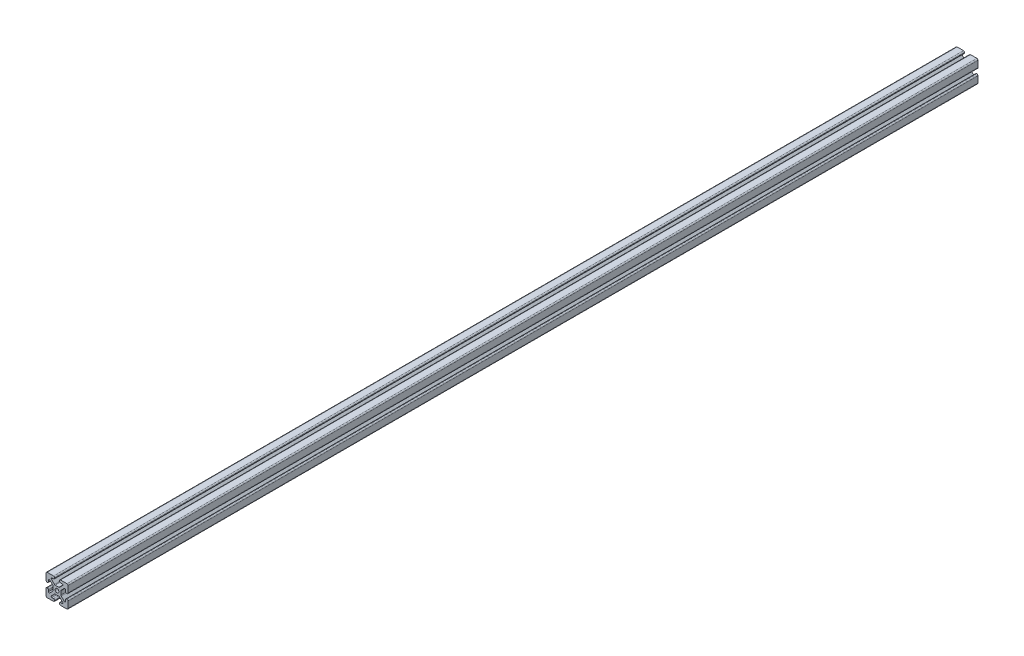
from build123d import *

# Parameters (mm, degrees)
SKETCH1_W           = 2.6797
SKETCH1_H           = 2.6797
BOSS_EXTRUDE1_DEPTH = 1574.8
FILLET2_R           = 2.032
FILLET3_R           = 2.032
FILLET4_R           = 1.27


with BuildPart() as part:
    # Sketch1 → Boss-Extrude1 (new body)
    with BuildSketch(Plane.XY):
        Polygon((-19.05, 16.176318041), (-19.05, 14.7447), (-17.618381959, 14.7447), align=None)
        Polygon((-14.7447, 17.618381959), (-14.7447, 19.05), (-16.176318041, 19.05), align=None)
        Polygon((14.7447, 19.05), (14.7447, 17.618381959), (16.176318041, 19.05), align=None)
        Polygon((17.618381959, 14.7447), (19.05, 14.7447), (19.05, 16.176318041), align=None)
        Polygon((19.05, -14.7447), (17.618381959, -14.7447), (19.05, -16.176318041), align=None)
        Polygon((16.176318041, -19.05), (14.7447, -17.618381959), (14.7447, -19.05), align=None)
        Polygon((19.05, -16.176318041), (17.618381959, -14.7447), (14.7447, -14.7447), (14.7447, -17.618381959), (16.176318041, -19.05), (19.05, -19.05), align=None)
        Polygon((19.05, -4.064), (14.7447, -4.064), (14.7447, -11.871018041), (17.618381959, -14.7447), (19.05, -14.7447), align=None)
        Polygon((17.618381959, -14.7447), (14.7447, -11.871018041), (14.7447, -14.7447), align=None)
        Polygon((14.7447, -14.7447), (11.871018041, -14.7447), (14.7447, -17.618381959), align=None)
        Polygon((11.871018041, -14.7447), (4.064, -14.7447), (4.064, -19.05), (14.7447, -19.05), (14.7447, -17.618381959), align=None)
        Polygon((14.7447, 6.7437), (14.7447, 4.064), (19.05, 4.064), (19.05, 14.7447), (17.618381959, 14.7447), (14.7447, 11.871018041), align=None)
        Polygon((14.7447, 14.7447), (14.7447, 11.871018041), (17.618381959, 14.7447), align=None)
        Polygon((16.176318041, 19.05), (14.7447, 17.618381959), (14.7447, 14.7447), (17.618381959, 14.7447), (19.05, 16.176318041), (19.05, 19.05), align=None)
        Polygon((4.064, 19.05), (4.064, 14.7447), (11.871018041, 14.7447), (14.7447, 17.618381959), (14.7447, 19.05), align=None)
        Polygon((14.7447, 17.618381959), (11.871018041, 14.7447), (14.7447, 14.7447), align=None)
        Polygon((-6.7437, 14.7447), (-4.064, 14.7447), (-4.064, 19.05), (-14.7447, 19.05), (-14.7447, 17.618381959), (-11.871018041, 14.7447), align=None)
        Polygon((-14.7447, 14.7447), (-11.871018041, 14.7447), (-14.7447, 17.618381959), align=None)
        Polygon((-14.7447, 14.7447), (-14.7447, 17.618381959), (-16.176318041, 19.05), (-19.05, 19.05), (-19.05, 16.176318041), (-17.618381959, 14.7447), align=None)
        Polygon((-17.618381959, 14.7447), (-14.7447, 11.871018041), (-14.7447, 14.7447), align=None)
        Polygon((-19.05, 4.064), (-14.7447, 4.064), (-14.7447, 6.7437), (-14.7447, 11.871018041), (-17.618381959, 14.7447), (-19.05, 14.7447), align=None)
        Polygon((-14.7447, -11.871018041), (-14.7447, -4.064), (-19.05, -4.064), (-19.05, -14.7447), (-17.618381959, -14.7447), align=None)
        Polygon((-14.7447, -14.7447), (-14.7447, -11.871018041), (-17.618381959, -14.7447), align=None)
        Polygon((-19.05, -16.176318041), (-17.618381959, -14.7447), (-19.05, -14.7447), align=None)
        Polygon((-14.7447, -14.7447), (-17.618381959, -14.7447), (-19.05, -16.176318041), (-19.05, -19.05), (-16.176318041, -19.05), (-14.7447, -17.618381959), align=None)
        Polygon((-16.176318041, -19.05), (-14.7447, -19.05), (-14.7447, -17.618381959), align=None)
        Polygon((-14.7447, -17.618381959), (-11.871018041, -14.7447), (-14.7447, -14.7447), align=None)
        Polygon((-4.064, -19.05), (-4.064, -14.7447), (-6.7437, -14.7447), (-11.871018041, -14.7447), (-14.7447, -17.618381959), (-14.7447, -19.05), align=None)
        Polygon((-6.7437, -6.7437), (-6.7437, -4.064), (-6.937681959, -4.064), (-14.7447, -11.871018041), (-14.7447, -14.7447), (-11.871018041, -14.7447), (-6.7437, -9.617381959), align=None)
        Polygon((-4.064, -6.937681959), (-4.064, -6.7437), (-6.7437, -6.7437), (-6.7437, -9.617381959), align=None)
        with Locations((-5.40385, -5.40385)):
            Rectangle(SKETCH1_W, SKETCH1_H)
        Polygon((6.7437, -6.7437), (4.064, -6.7437), (4.064, -6.937681959), (11.871018041, -14.7447), (14.7447, -14.7447), (14.7447, -11.871018041), (6.937681959, -4.064), (6.7437, -4.064), align=None)
        Polygon((4.064, 6.937681959), (4.064, 6.7437), (6.7437, 6.7437), (9.617381959, 6.7437), (14.7447, 11.871018041), (14.7447, 14.7447), (11.871018041, 14.7447), align=None)
        Polygon((6.7437, 6.7437), (6.7437, 4.064), (6.937681959, 4.064), (9.617381959, 6.7437), align=None)
        Polygon((-9.617381959, 6.7437), (-6.7437, 6.7437), (-6.7437, 9.617381959), (-11.871018041, 14.7447), (-14.7447, 14.7447), (-14.7447, 11.871018041), align=None)
        Polygon((-6.7437, 6.7437), (-4.064, 6.7437), (-4.064, 6.937681959), (-6.7437, 9.617381959), align=None)
        Polygon((-6.937681959, 4.064), (-6.7437, 4.064), (-6.7437, 6.7437), (-9.617381959, 6.7437), align=None)
        with Locations((-5.40385, 5.40385)):
            Rectangle(SKETCH1_W, SKETCH1_H)
        Polygon((-6.7437, 3.870018041), (-4.064, 1.190318041), (-4.064, 4.064), (-6.7437, 4.064), align=None)
        Polygon((-4.064, -1.190318041), (-4.064, 1.190318041), (-6.7437, 3.870018041), (-6.7437, -3.870018041), align=None)
        with BuildLine():
            ThreePointArc((-3.299979026, 0.426297067), (-2.352827104, 2.352827104), (-0.426297067, 3.299979026))
            Line((-0.426297067, 3.299979026), (-1.190318041, 4.064))
            Line((-1.190318041, 4.064), (-4.064, 4.064))
            Line((-4.064, 4.064), (-4.064, 1.190318041))
            Line((-4.064, 1.190318041), (-3.299979026, 0.426297067))
        make_face()
        Polygon((-4.064, 4.064), (-1.190318041, 4.064), (-3.870018041, 6.7437), (-4.064, 6.7437), align=None)
        Polygon((-1.190318041, 4.064), (0, 4.064), (0, 6.7437), (-3.870018041, 6.7437), align=None)
        with BuildLine():
            ThreePointArc((-0.426297067, 3.299979026), (-0.213589032, 3.32053768), (0, 3.3274))
            Line((0, 3.3274), (0, 4.064))
            Line((0, 4.064), (-1.190318041, 4.064))
            Line((-1.190318041, 4.064), (-0.426297067, 3.299979026))
        make_face()
        with BuildLine():
            Line((0, 4.064), (0, 3.3274))
            ThreePointArc((0, 3.3274), (0.213589032, 3.32053768), (0.426297067, 3.299979026))
            Line((0.426297067, 3.299979026), (1.190318041, 4.064))
            Line((1.190318041, 4.064), (0, 4.064))
        make_face()
        Polygon((0, 6.7437), (0, 4.064), (1.190318041, 4.064), (3.870018041, 6.7437), align=None)
        Polygon((3.870018041, 6.7437), (1.190318041, 4.064), (4.064, 4.064), (4.064, 6.7437), align=None)
        with Locations((5.40385, 5.40385)):
            Rectangle(SKETCH1_W, SKETCH1_H)
        Polygon((4.064, 4.064), (4.064, 1.190318041), (6.7437, 3.870018041), (6.7437, 4.064), align=None)
        Polygon((4.064, 1.190318041), (4.064, 0), (6.7437, 0), (6.7437, 3.870018041), align=None)
        with BuildLine():
            ThreePointArc((0.426297067, 3.299979026), (2.352827104, 2.352827104), (3.299979026, 0.426297067))
            Line((3.299979026, 0.426297067), (4.064, 1.190318041))
            Line((4.064, 1.190318041), (4.064, 4.064))
            Line((4.064, 4.064), (1.190318041, 4.064))
            Line((1.190318041, 4.064), (0.426297067, 3.299979026))
        make_face()
        with BuildLine():
            ThreePointArc((3.299979026, 0.426297067), (3.32053768, 0.213589032), (3.3274, 0))
            Line((3.3274, 0), (4.064, 0))
            Line((4.064, 0), (4.064, 1.190318041))
            Line((4.064, 1.190318041), (3.299979026, 0.426297067))
        make_face()
        with BuildLine():
            Line((4.064, 0), (3.3274, 0))
            ThreePointArc((3.3274, 0), (3.32053768, -0.213589032), (3.299979026, -0.426297067))
            Line((3.299979026, -0.426297067), (4.064, -1.190318041))
            Line((4.064, -1.190318041), (4.064, 0))
        make_face()
        Polygon((6.7437, 0), (4.064, 0), (4.064, -1.190318041), (6.7437, -3.870018041), align=None)
        Polygon((6.7437, -3.870018041), (4.064, -1.190318041), (4.064, -4.064), (6.7437, -4.064), align=None)
        with BuildLine():
            Line((4.064, -1.190318041), (3.299979026, -0.426297067))
            ThreePointArc((3.299979026, -0.426297067), (2.352827104, -2.352827104), (0.426297067, -3.299979026))
            Line((0.426297067, -3.299979026), (1.190318041, -4.064))
            Line((1.190318041, -4.064), (4.064, -4.064))
            Line((4.064, -4.064), (4.064, -1.190318041))
        make_face()
        with Locations((5.40385, -5.40385)):
            Rectangle(SKETCH1_W, SKETCH1_H)
        Polygon((4.064, -6.7437), (4.064, -4.064), (1.190318041, -4.064), (3.870018041, -6.7437), align=None)
        Polygon((3.870018041, -6.7437), (1.190318041, -4.064), (-1.190318041, -4.064), (-3.870018041, -6.7437), align=None)
        with BuildLine():
            Line((1.190318041, -4.064), (0.426297067, -3.299979026))
            ThreePointArc((0.426297067, -3.299979026), (0, -3.3274), (-0.426297067, -3.299979026))
            Line((-0.426297067, -3.299979026), (-1.190318041, -4.064))
            Line((-1.190318041, -4.064), (1.190318041, -4.064))
        make_face()
        with BuildLine():
            Line((-1.190318041, -4.064), (-0.426297067, -3.299979026))
            ThreePointArc((-0.426297067, -3.299979026), (-2.352827104, -2.352827104), (-3.299979026, -0.426297067))
            Line((-3.299979026, -0.426297067), (-4.064, -1.190318041))
            Line((-4.064, -1.190318041), (-4.064, -4.064))
            Line((-4.064, -4.064), (-1.190318041, -4.064))
        make_face()
        Polygon((-4.064, -4.064), (-4.064, -1.190318041), (-6.7437, -3.870018041), (-6.7437, -4.064), align=None)
        with BuildLine():
            ThreePointArc((-3.299979026, -0.426297067), (-3.3274, 0), (-3.299979026, 0.426297067))
            Line((-3.299979026, 0.426297067), (-4.064, 1.190318041))
            Line((-4.064, 1.190318041), (-4.064, -1.190318041))
            Line((-4.064, -1.190318041), (-3.299979026, -0.426297067))
        make_face()
        Polygon((4.064, -6.937681959), (4.064, -6.7437), (3.870018041, -6.7437), align=None)
        Polygon((6.937681959, -4.064), (6.7437, -3.870018041), (6.7437, -4.064), align=None)
        Polygon((6.7437, 4.064), (6.7437, 3.870018041), (6.937681959, 4.064), align=None)
        Polygon((4.064, 6.937681959), (3.870018041, 6.7437), (4.064, 6.7437), align=None)
        Polygon((-4.064, 6.7437), (-3.870018041, 6.7437), (-4.064, 6.937681959), align=None)
        Polygon((-6.937681959, 4.064), (-6.7437, 3.870018041), (-6.7437, 4.064), align=None)
        Polygon((-6.7437, -4.064), (-6.7437, -3.870018041), (-6.937681959, -4.064), align=None)
        Polygon((-4.064, -6.937681959), (-3.870018041, -6.7437), (-4.064, -6.7437), align=None)
        Polygon((-3.870018041, -6.7437), (-1.190318041, -4.064), (-4.064, -4.064), (-4.064, -6.7437), align=None)
    extrude(amount=BOSS_EXTRUDE1_DEPTH)

    # Fillet2
    fillet2_edges = [part.edges().sort_by_distance(p)[0] for p in [
        (6.7437, 3.870018041, 787.4),
        (6.7437, -3.870018041, 787.4),
        (3.870018041, -6.7437, 787.4),
        (-3.870018041, -6.7437, 787.4),
        (-6.7437, -3.870018041, 787.4),
        (-6.7437, 3.870018041, 787.4),
        (-3.870018041, 6.7437, 787.4),
        (3.870018041, 6.7437, 787.4),
    ]]
    fillet(fillet2_edges, radius=FILLET2_R)

    # Fillet3
    fillet3_edges = [part.edges().sort_by_distance(p)[0] for p in [
        (14.7447, 4.064, 787.4),
        (14.7447, -4.064, 787.4),
        (19.05, -4.064, 787.4),
        (19.05, -19.05, 787.4),
        (4.064, -19.05, 787.4),
        (4.064, -14.7447, 787.4),
        (-4.064, -14.7447, 787.4),
        (-4.064, -19.05, 787.4),
        (-19.05, -19.05, 787.4),
        (-19.05, -4.064, 787.4),
        (-14.7447, -4.064, 787.4),
        (-14.7447, 4.064, 787.4),
        (-19.05, 4.064, 787.4),
        (-19.05, 19.05, 787.4),
        (-4.064, 19.05, 787.4),
        (-4.064, 14.7447, 787.4),
        (4.064, 14.7447, 787.4),
        (4.064, 19.05, 787.4),
        (19.05, 19.05, 787.4),
        (19.05, 4.064, 787.4),
    ]]
    fillet(fillet3_edges, radius=FILLET3_R)

    # Fillet4
    fillet4_edges = [part.edges().sort_by_distance(p)[0] for p in [
        (14.7447, 11.871018041, 787.4),
        (14.7447, -11.871018041, 787.4),
        (11.871018041, -14.7447, 787.4),
        (-11.871018041, -14.7447, 787.4),
        (-14.7447, -11.871018041, 787.4),
        (-14.7447, 11.871018041, 787.4),
        (-11.871018041, 14.7447, 787.4),
        (11.871018041, 14.7447, 787.4),
    ]]
    fillet(fillet4_edges, radius=FILLET4_R)


solid = part.part
